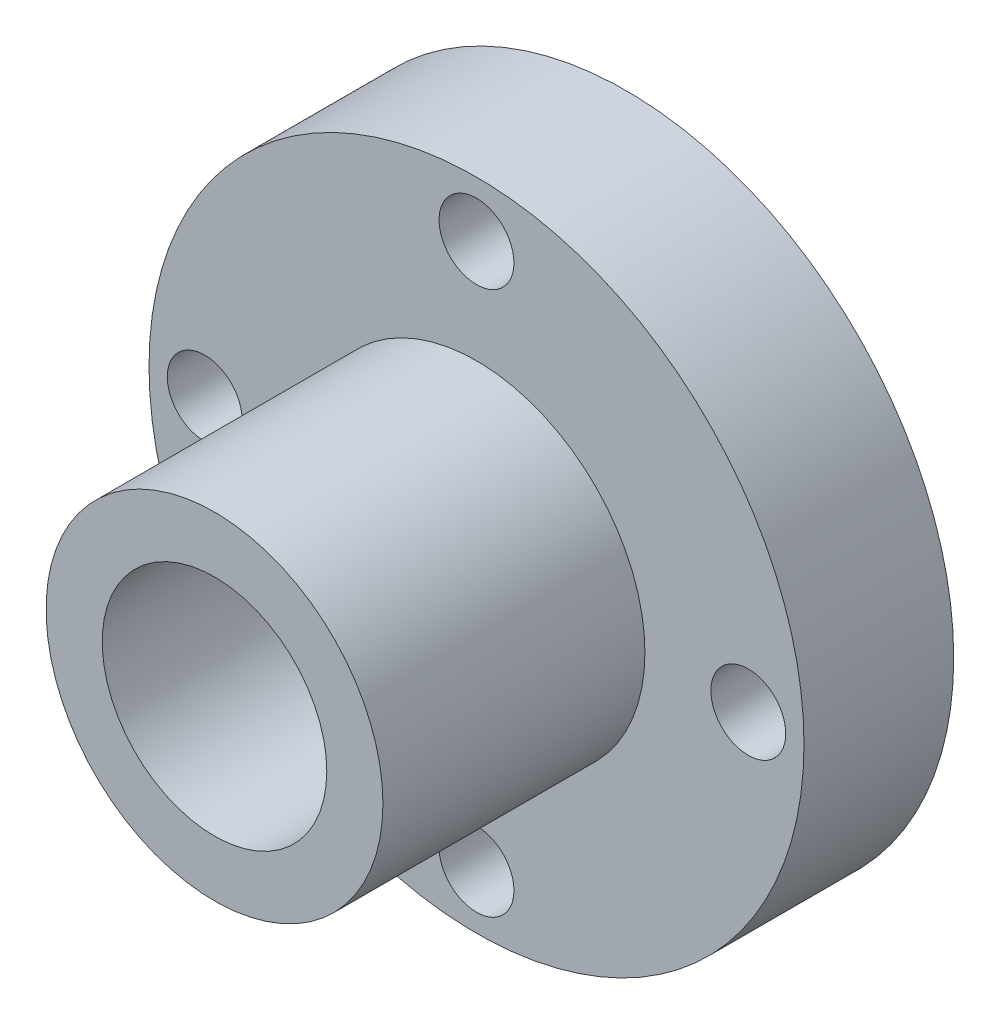
from build123d import *

# Parameters (mm, degrees)
ESBO_O2_R                  = 17.5
RESSALTO_EXTRUS_O2_DEPTH   = 8
CORTE_EXTRUS_O2_DEPTH      = 27.009613607
CORTE_EXTRUS_O2_DEPTH_BACK = 27.009613607
ESBO_O6_R                  = 2
ESBO_O7_R                  = 9
ESBO_O7_R_2                = 6
RESSALTO_EXTRUS_O3_DEPTH   = 14
CORTE_EXTRUS_O3_DEPTH      = 29.434134416
CORTE_EXTRUS_O3_DEPTH_BACK = 29.434134416
ESBO_O8_R                  = 6


with BuildPart() as part:
    # Esboço2 → Ressalto-extrusão2 (new body)
    with BuildSketch(Plane.XY):
        Circle(ESBO_O2_R)
    extrude(amount=RESSALTO_EXTRUS_O2_DEPTH)

    # Esboço6 → Corte-extrusão2 (cut, two sides: drawn at the far end of the back side and taken through both)
    with BuildSketch(Plane.XY.offset(8).offset(-CORTE_EXTRUS_O2_DEPTH_BACK)):
        with Locations((0, 14.523179991)):
            Circle(ESBO_O6_R)
        with Locations((14.523179991, 0)):
            Circle(ESBO_O6_R)
        with Locations((0, -14.523179991)):
            Circle(ESBO_O6_R)
        with Locations((-14.523179991, 0)):
            Circle(ESBO_O6_R)
    extrude(amount=CORTE_EXTRUS_O2_DEPTH + CORTE_EXTRUS_O2_DEPTH_BACK, mode=Mode.SUBTRACT)

    # Esboço7 → Ressalto-extrusão3 (add)
    with BuildSketch(Plane.XY.offset(8)):
        Circle(ESBO_O7_R)
        Circle(ESBO_O7_R_2, mode=Mode.SUBTRACT)
    extrude(amount=RESSALTO_EXTRUS_O3_DEPTH)

    # Esboço8 → Corte-extrusão3 (cut, two sides: drawn at the far end of the back side and taken through both)
    with BuildSketch(Plane.XY.offset(8).offset(-CORTE_EXTRUS_O3_DEPTH_BACK)):
        Circle(ESBO_O8_R)
    extrude(amount=CORTE_EXTRUS_O3_DEPTH + CORTE_EXTRUS_O3_DEPTH_BACK, mode=Mode.SUBTRACT)


solid = part.part
